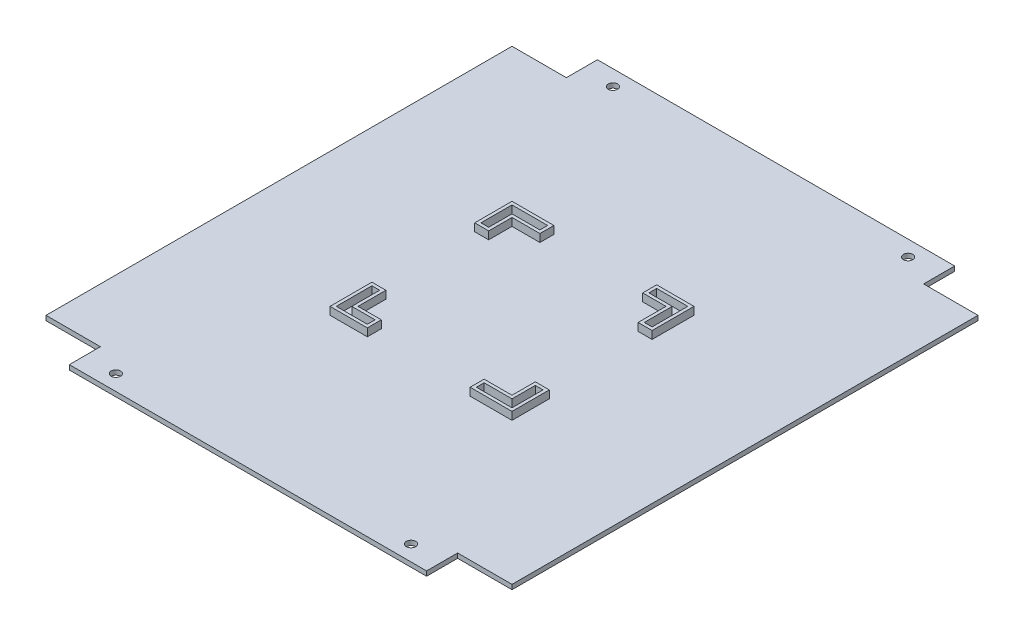
from build123d import *

# Parameters (mm, degrees)
EXTRUDE_1_DEPTH     = 3
SKETCH_2_R          = 3
CUT_EXTRUDE_1_DEPTH = 3
EXTRUDE_2_DEPTH     = 5


with BuildPart() as part:
    # 草图1 → 凸台-拉伸1 (new body)
    with BuildSketch(Plane(origin=(0, 0, 0), x_dir=(1, 0, 0), z_dir=(0, 1, 0))):
        Polygon((55, 0), (285, 0), (285, 20), (320, 20), (320, 55), (320, 285), (320, 320), (285, 320), (285, 340), (55, 340), (55, 320), (20, 320), (20, 285), (20, 55), (20, 20), (55, 20), align=None)
    extrude(amount=EXTRUDE_1_DEPTH)

    # 草图2 → 切除-拉伸1 (cut)
    with BuildSketch(Plane(origin=(0, 3, 0), x_dir=(1, 0, 0), z_dir=(0, 1, 0))):
        with Locations(Location((75, 330, 0), (0, 0, 270))):
            Circle(SKETCH_2_R)
        with Locations(Location((265, 330, 0), (0, 0, 90))):
            Circle(SKETCH_2_R)
        with Locations(Location((265, 10, 0), (0, 0, 270))):
            Circle(SKETCH_2_R)
        with Locations(Location((75, 10, 0), (0, 0, 90))):
            Circle(SKETCH_2_R)
    extrude(amount=-CUT_EXTRUDE_1_DEPTH, mode=Mode.SUBTRACT)

    # 草图3 → 凸台-拉伸2 (add)
    # profile 1 of 4: a face of its own
    with BuildSketch(Plane(origin=(0, 3, 0), x_dir=(1, 0, 0), z_dir=(0, 1, 0))):
        Polygon((111.431457505, 228.568542495), (111.431457505, 204.568542495), (120.431457505, 204.568542495), (120.431457505, 219.568542495), (138.38115839, 219.568542495), (138.38115839, 228.568542495), align=None)
        Polygon((113.431457505, 226.568542495), (113.431457505, 206.568542495), (118.431457505, 206.568542495), (118.431457505, 221.568542495), (136.38115839, 221.568542495), (136.38115839, 226.568542495), align=None, mode=Mode.SUBTRACT)
    # profile 2 of 4: a face of its own
    with BuildSketch(Plane(origin=(0, 3, 0), x_dir=(1, 0, 0), z_dir=(0, 1, 0))):
        Polygon((228.568542495, 228.568542495), (204.568542495, 228.568542495), (204.568542495, 219.568542495), (219.568542495, 219.568542495), (219.568542495, 201.61884161), (228.568542495, 201.61884161), align=None)
        Polygon((226.568542495, 226.568542495), (206.568542495, 226.568542495), (206.568542495, 221.568542495), (221.568542495, 221.568542495), (221.568542495, 203.61884161), (226.568542495, 203.61884161), align=None, mode=Mode.SUBTRACT)
    # profile 3 of 4: a face of its own
    with BuildSketch(Plane(origin=(0, 3, 0), x_dir=(1, 0, 0), z_dir=(0, 1, 0))):
        Polygon((228.568542495, 111.431457505), (228.568542495, 135.431457505), (219.568542495, 135.431457505), (219.568542495, 120.431457505), (201.61884161, 120.431457505), (201.61884161, 111.431457505), align=None)
        Polygon((226.568542495, 113.431457505), (226.568542495, 133.431457505), (221.568542495, 133.431457505), (221.568542495, 118.431457505), (203.61884161, 118.431457505), (203.61884161, 113.431457505), align=None, mode=Mode.SUBTRACT)
    # profile 4 of 4: a face of its own
    with BuildSketch(Plane(origin=(0, 3, 0), x_dir=(1, 0, 0), z_dir=(0, 1, 0))):
        Polygon((111.431457505, 111.431457505), (135.431457505, 111.431457505), (135.431457505, 120.431457505), (120.431457505, 120.431457505), (120.431457505, 138.38115839), (111.431457505, 138.38115839), align=None)
        Polygon((113.431457505, 113.431457505), (133.431457505, 113.431457505), (133.431457505, 118.431457505), (118.431457505, 118.431457505), (118.431457505, 136.38115839), (113.431457505, 136.38115839), align=None, mode=Mode.SUBTRACT)
    extrude(amount=EXTRUDE_2_DEPTH)


solid = part.part
